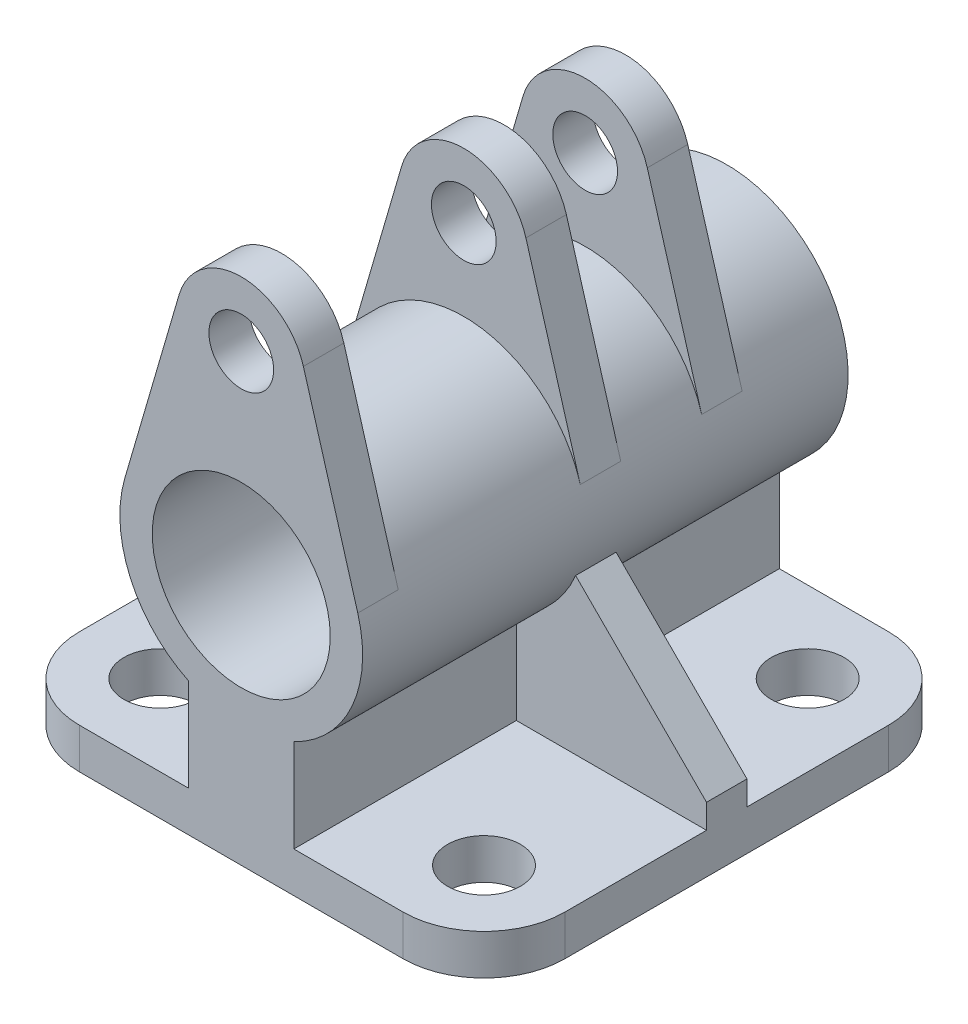
from build123d import *

# Parameters (mm, degrees)
SKETCH_1_R               = 11
EXTRUDE_1_DEPTH          = 30
SKETCH_1_3_R             = 4
EXTRUDE_2_DEPTH          = 2.5
EXTRUDE_START            = -15
SKETCH_1_6_R             = 4
EXTRUDE_4_DEPTH          = 2.5
EXTRUDE_START_2          = 30
SKETCH_1_7_R             = 4
EXTRUDE_5_DEPTH          = 5
SKETCH_7_R               = 4.5
CUT_EXTRUDE_1_DEPTH      = 76.953933407
MIRROR_2_COPY_1_SKETCH_R = 4.5
MIRROR_2_COPY_1_DEPTH    = 76.953933407
FILLET_1_R               = 10


with BuildPart() as part:
    # Эскиз1 → Бобышка-Вытянуть1 (new, symmetric)
    with BuildSketch(Plane.XY):
        with BuildLine():
            Line((-30, -30), (30, -30))
            Line((30, -30), (30, -25))
            Line((30, -25), (6.5, -25))
            Line((6.5, -25), (6.5, -13.518505835))
            ThreePointArc((6.5, -13.518505835), (0, 15), (-6.5, -13.518505835))
            Line((-6.5, -13.518505835), (-6.5, -25))
            Line((-6.5, -25), (-30, -25))
            Line((-30, -25), (-30, -30))
        make_face()
        Circle(SKETCH_1_R, mode=Mode.SUBTRACT)
    extrude(amount=EXTRUDE_1_DEPTH, both=True)

    # Эскиз1<3> → Бобышка-Вытянуть2 (add, symmetric)
    # profile 1 of 3: a face of its own
    with BuildSketch(Plane.XY):
        with BuildLine():
            Line((-7.68, 27.24), (-14.4, 4.2))
            ThreePointArc((-14.4, 4.2), (0, 15), (14.4, 4.2))
            Line((14.4, 4.2), (7.68, 27.24))
            ThreePointArc((7.68, 27.24), (0, 33), (-7.68, 27.24))
        make_face()
        with Locations((0, 25)):
            Circle(SKETCH_1_3_R, mode=Mode.SUBTRACT)
    # profile 2 of 3: a face of its own
    with BuildSketch(Plane.XY):
        with BuildLine():
            Line((6.5, -25), (30, -25))
            Line((30, -25), (30, -22))
            Line((30, -22), (13.823441352, -5.823441352))
            ThreePointArc((13.823441352, -5.823441352), (10.865729218, -10.340982959), (6.5, -13.518505835))
            Line((6.5, -13.518505835), (6.5, -25))
        make_face()
    # profile 3 of 3: a face of its own
    with BuildSketch(Plane.XY):
        with BuildLine():
            Line((-30, -22), (-30, -25))
            Line((-30, -25), (-6.5, -25))
            Line((-6.5, -25), (-6.5, -13.518505835))
            ThreePointArc((-6.5, -13.518505835), (-10.865729218, -10.340982959), (-13.823441352, -5.823441352))
            Line((-13.823441352, -5.823441352), (-30, -22))
        make_face()
    extrude(amount=EXTRUDE_2_DEPTH, both=True)

    # Эскиз1<6> → Бобышка-Вытянуть4 (add, symmetric)
    with BuildSketch(Plane.XY.offset(EXTRUDE_START)):
        with BuildLine():
            Line((-7.68, 27.24), (-14.4, 4.2))
            ThreePointArc((-14.4, 4.2), (0, 15), (14.4, 4.2))
            Line((14.4, 4.2), (7.68, 27.24))
            ThreePointArc((7.68, 27.24), (0, 33), (-7.68, 27.24))
        make_face()
        with Locations((0, 25)):
            Circle(SKETCH_1_6_R, mode=Mode.SUBTRACT)
    extrude(amount=EXTRUDE_4_DEPTH, both=True)

    # Эскиз1<7> → Бобышка-Вытянуть5 (add)
    with BuildSketch(Plane.XY.offset(EXTRUDE_START_2)):
        with BuildLine():
            Line((-7.68, 27.24), (-14.4, 4.2))
            ThreePointArc((-14.4, 4.2), (0, 15), (14.4, 4.2))
            Line((14.4, 4.2), (7.68, 27.24))
            ThreePointArc((7.68, 27.24), (0, 33), (-7.68, 27.24))
        make_face()
        with Locations((0, 25)):
            Circle(SKETCH_1_7_R, mode=Mode.SUBTRACT)
    extrude(amount=-EXTRUDE_5_DEPTH)

    # Эскиз7 → Вырез-Вытянуть1 (cut, through all)
    with BuildSketch(Plane.XZ.offset(30)):
        with Locations(Location((-20, 20, 0), (0, 0, 270))):
            Circle(SKETCH_7_R)
    cut_extrude_1 = extrude(amount=-CUT_EXTRUDE_1_DEPTH, mode=Mode.SUBTRACT)

    # Зеркальное отражение1: Вырез-Вытянуть1 across plane
    add(cut_extrude_1.mirror(Plane(origin=(0, 0, 0), x_dir=(0, 0, 1), z_dir=(1, 0, 0))), mode=Mode.SUBTRACT)

    # Зеркальное отражение2: Вырез-Вытянуть1 across plane
    add(cut_extrude_1.mirror(Plane.XY), mode=Mode.SUBTRACT)

    # Зеркальное отражение2 copy 1 sketch → Зеркальное отражение2 copy 1 (cut, through all)
    with BuildSketch(Plane(origin=(0, -30, 0), x_dir=(-1, 0, 0), z_dir=(0, -1, 0))):
        with Locations(Location((-20, 20, 0), (0, 0, 270))):
            Circle(MIRROR_2_COPY_1_SKETCH_R)
    extrude(amount=-MIRROR_2_COPY_1_DEPTH, mode=Mode.SUBTRACT)

    # Скругление1
    fillet_1_edges = [part.edges().sort_by_distance(p)[0] for p in [
        (30, -27.5, -30),
        (-30, -27.5, -30),
        (-30, -27.5, 30),
        (30, -27.5, 30),
    ]]
    fillet(fillet_1_edges, radius=FILLET_1_R)


solid = part.part
